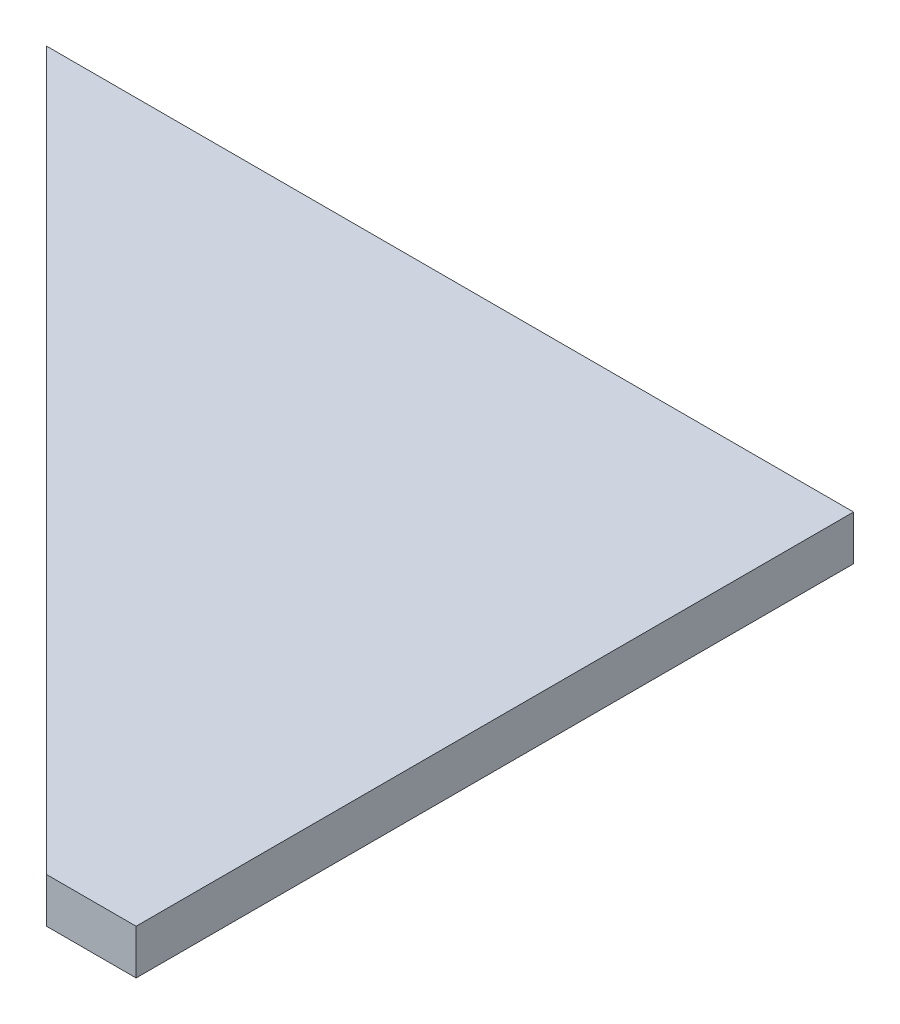
from build123d import *

# Parameters (mm, degrees)
SKETCH1_W           = 12.7
SKETCH1_H           = 101.6
BOSS_EXTRUDE1_DEPTH = 6.35


with BuildPart() as part:
    # Sketch1 → Boss-Extrude1 (new body)
    with BuildSketch(Plane(origin=(0, 0, 0), x_dir=(1, 0, 0), z_dir=(0, 1, 0))):
        Polygon((-107.95, 50.8), (-6.35, 50.8), (-6.35, -50.8), align=None)
        Rectangle(SKETCH1_W, SKETCH1_H)
    extrude(amount=BOSS_EXTRUDE1_DEPTH)


solid = part.part
